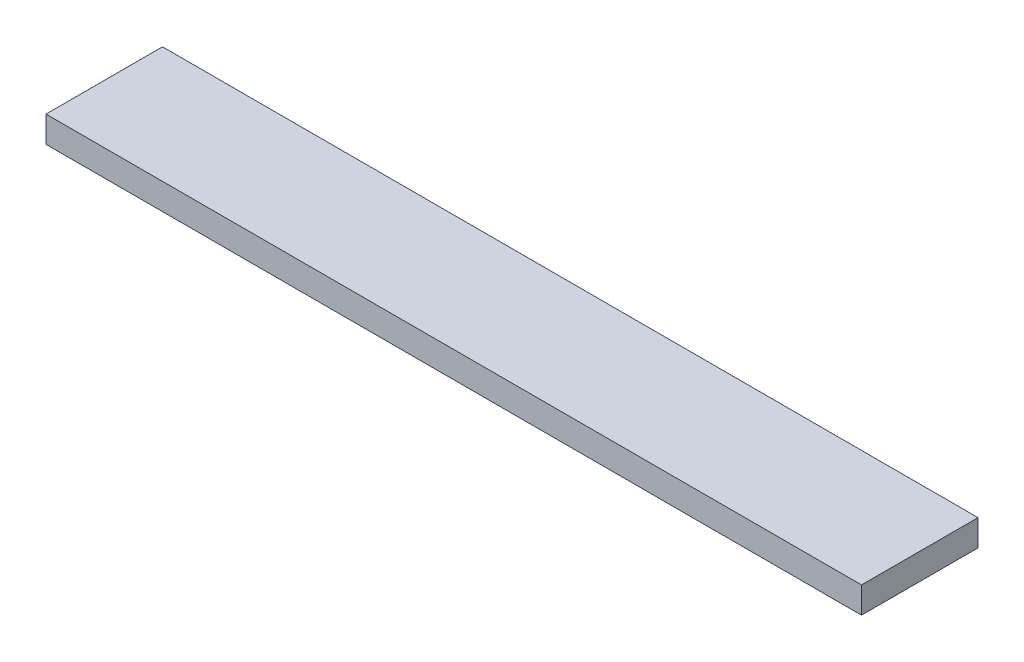
from build123d import *

# Parameters (mm, degrees)
SKETCH1_W           = 140
SKETCH1_H           = 20
BOSS_EXTRUDE1_DEPTH = 4.5


with BuildPart() as part:
    # Sketch1 → Boss-Extrude1 (new body)
    with BuildSketch(Plane(origin=(0, 0, 0), x_dir=(1, 0, 0), z_dir=(0, 1, 0))):
        with Locations((70, 10)):
            Rectangle(SKETCH1_W, SKETCH1_H)
    extrude(amount=BOSS_EXTRUDE1_DEPTH)


solid = part.part
